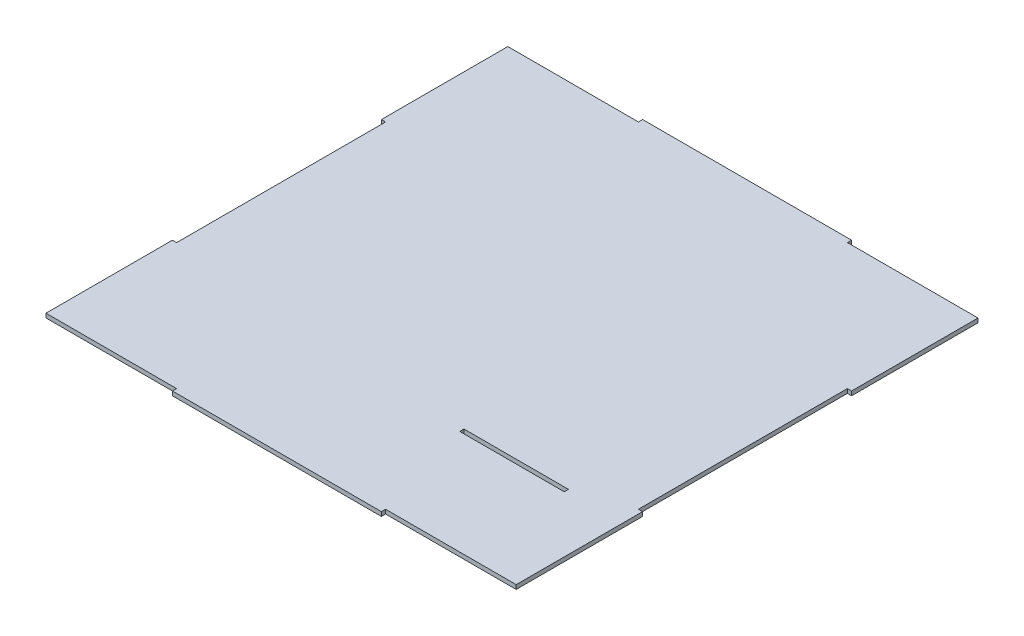
from build123d import *

# Parameters (mm, degrees)
SKETCH1_W           = 100
SKETCH1_H           = 4
BOSS_EXTRUDE1_DEPTH = 4


with BuildPart() as part:
    # Sketch1 → Boss-Extrude1 (new body)
    with BuildSketch(Plane(origin=(0, 0, 0), x_dir=(1, 0, 0), z_dir=(0, 1, 0))):
        Polygon((-100, -221), (-225, -221), (-225, -100), (-221, -100), (-221, 100), (-225, 100), (-225, 221), (-100, 221), (-100, 225), (100, 225), (100, 221), (225, 221), (225, 100), (221, 100), (221, -100), (225, -100), (225, -221), (100, -221), (100, -225), (-100, -225), align=None)
        with Locations((121, -119)):
            Rectangle(SKETCH1_W, SKETCH1_H, mode=Mode.SUBTRACT)
    extrude(amount=BOSS_EXTRUDE1_DEPTH)


solid = part.part
